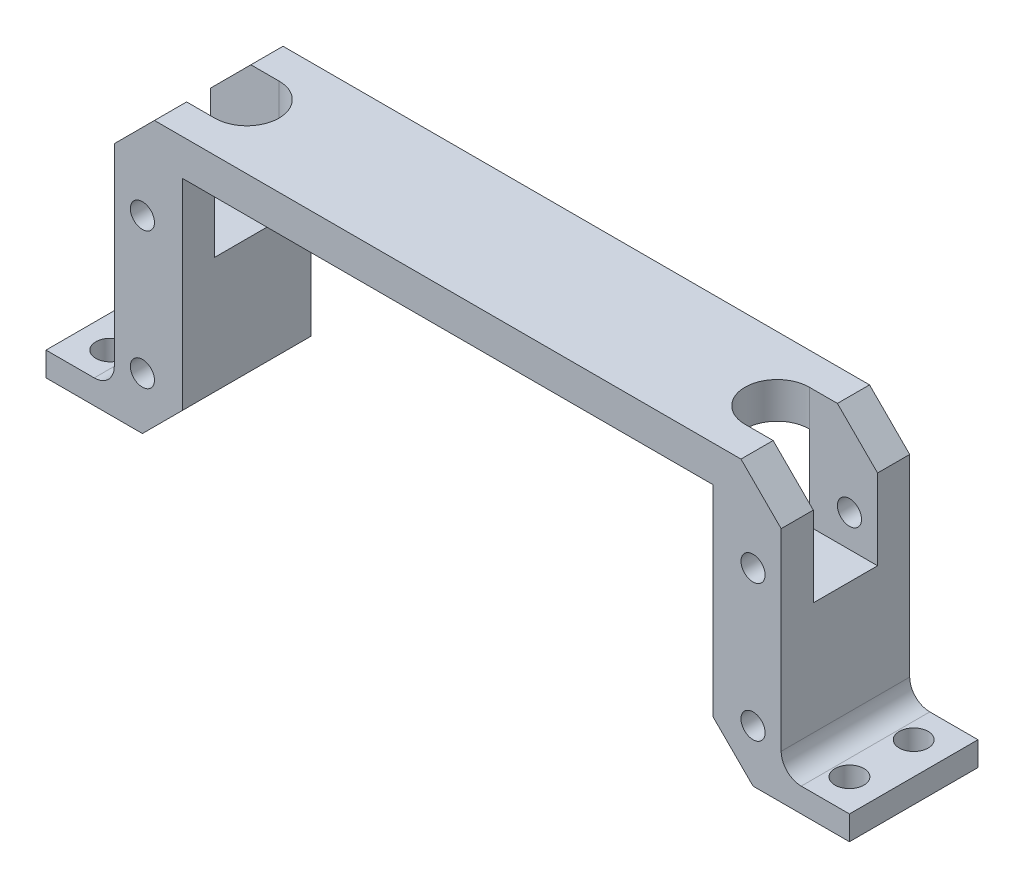
from build123d import *

# Parameters (mm, degrees)
BOSS_EXTRUDE1_DEPTH = 8
CHAMFER5_SIZE       = 5
FILLET1_R           = 2.5
SKETCH2_R           = 1.5
CUT_EXTRUDE1_DEPTH  = 63.819184968
SKETCH3_R           = 1.8
CUT_EXTRUDE2_DEPTH  = 60.634302209
SKETCH5_W           = 8.5
SKETCH5_H           = 8
CUT_EXTRUDE3_DEPTH  = 15
CUT_EXTRUDE5_DEPTH  = 15


with BuildPart() as part:
    # Sketch1 → Boss-Extrude1 (new, symmetric)
    with BuildSketch(Plane.XY):
        Polygon((-50, 0), (-33, 0), (-33, 30), (33, 30), (33, 0), (50, 0), (50, 3), (41.5, 3), (41.5, 34.5), (-41.5, 34.5), (-41.5, 3), (-50, 3), align=None)
    extrude(amount=BOSS_EXTRUDE1_DEPTH, both=True)

    # Chamfer5
    chamfer5_edges = [part.edges().sort_by_distance(p)[0] for p in [
        (-41.5, 34.5, 0),
        (41.5, 34.5, 0),
        (33, 0, 0),
        (-33, 0, 0),
    ]]
    chamfer(chamfer5_edges, length=CHAMFER5_SIZE)

    # Fillet1
    fillet1_edges = [part.edges().sort_by_distance(p)[0] for p in [
        (-41.5, 3, 0),
        (41.5, 3, 0),
    ]]
    fillet(fillet1_edges, radius=FILLET1_R)

    # Sketch2 → Cut-Extrude1 (cut, through all)
    with BuildSketch(Plane.XY.offset(8)):
        with Locations((38, 23.5)):
            Circle(SKETCH2_R)
        with Locations((38, 6.5)):
            Circle(SKETCH2_R)
    cut_extrude1 = extrude(amount=-CUT_EXTRUDE1_DEPTH, mode=Mode.SUBTRACT)

    # Mirror1: Cut-Extrude1 across plane
    add(cut_extrude1.mirror(Plane(origin=(0, 0, 0), x_dir=(0, 0, 1), z_dir=(1, 0, 0))), mode=Mode.SUBTRACT)

    # Sketch3 → Cut-Extrude2 (cut, through all)
    with BuildSketch(Plane(origin=(0, 3, 0), x_dir=(1, 0, 0), z_dir=(0, 1, 0))):
        with Locations(Location((46, 4, 0), (0, 0, 270))):
            Circle(SKETCH3_R)
        with Locations(Location((46, -4, 0), (0, 0, 270))):
            Circle(SKETCH3_R)
        with Locations(Location((-46, 4, 0), (0, 0, 270))):
            Circle(SKETCH3_R)
        with Locations(Location((-46, -4, 0), (0, 0, 270))):
            Circle(SKETCH3_R)
    extrude(amount=-CUT_EXTRUDE2_DEPTH, mode=Mode.SUBTRACT)

    # Sketch5 → Cut-Extrude3 (cut)
    with BuildSketch(Plane(origin=(0, 34.5, 0), x_dir=(1, 0, 0), z_dir=(0, 1, 0))):
        with Locations((37.25, 0)):
            Rectangle(SKETCH5_W, SKETCH5_H)
        with Locations((-37.25, 0)):
            Rectangle(SKETCH5_W, SKETCH5_H)
    extrude(amount=-CUT_EXTRUDE3_DEPTH, mode=Mode.SUBTRACT)

    # Sketch7 → Cut-Extrude5 (cut)
    with BuildSketch(Plane(origin=(0, 34.5, 0), x_dir=(1, 0, 0), z_dir=(0, 1, 0))):
        with BuildLine():
            Line((33, 4), (33, -4))
            ThreePointArc((33, -4), (29, 0), (33, 4))
        make_face()
        with BuildLine():
            Line((-33, 4), (-33, -4))
            ThreePointArc((-33, -4), (-29, 0), (-33, 4))
        make_face()
    extrude(amount=-CUT_EXTRUDE5_DEPTH, mode=Mode.SUBTRACT)


solid = part.part
